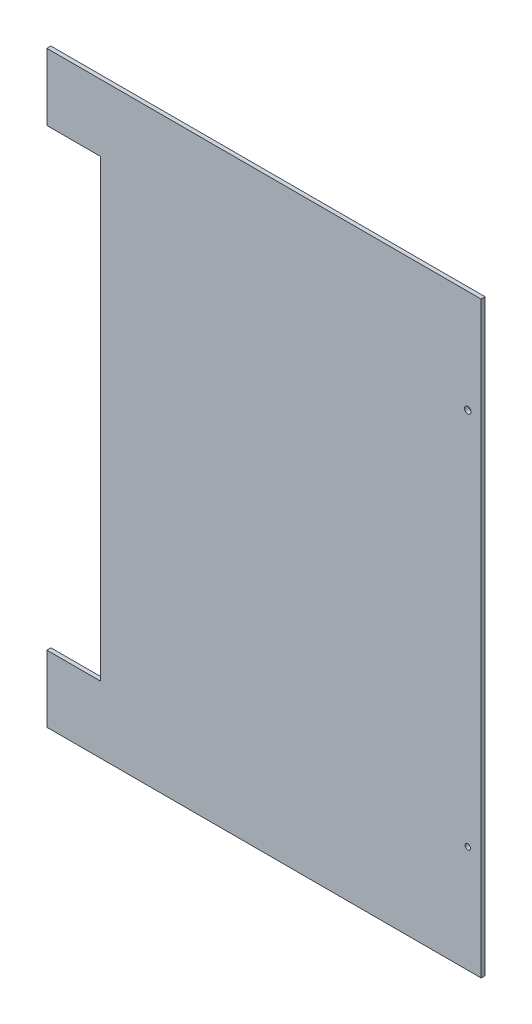
from build123d import *

# Parameters (mm, degrees)
SKETCH1_W           = 325
SKETCH1_H           = 70
SKETCH1_H_2         = 300
BOSS_EXTRUDE1_DEPTH = 3
SKETCH2_W           = 40
SKETCH2_H           = 340
CUT_EXTRUDE1_DEPTH  = 3
SKETCH3_R           = 2
SKETCH3_R_2         = 2.415919743
CUT_EXTRUDE2_DEPTH  = 3


with BuildPart() as part:
    # Sketch1 → Boss-Extrude1 (new body)
    with BuildSketch(Plane.XY):
        with Locations((16, 188.326300096)):
            Rectangle(SKETCH1_W, SKETCH1_H)
        with Locations((16, 3.326300096)):
            Rectangle(SKETCH1_W, SKETCH1_H_2)
        with Locations((16, -181.673699904)):
            Rectangle(SKETCH1_W, SKETCH1_H)
    extrude(amount=BOSS_EXTRUDE1_DEPTH)

    # Sketch2 → Cut-Extrude1 (cut)
    with BuildSketch(Plane.XY.offset(3)):
        with Locations((-126.5, 3.326300096)):
            Rectangle(SKETCH2_W, SKETCH2_H)
    extrude(amount=-CUT_EXTRUDE1_DEPTH, mode=Mode.SUBTRACT)

    # Sketch3 → Cut-Extrude2 (cut)
    with BuildSketch(Plane(origin=(0, 0, 0), x_dir=(-1, 0, 0), z_dir=(0, 0, -1))):
        with Locations((-168.5, -136.673699904)):
            Circle(SKETCH3_R)
        with Locations((-168.5, 146.326300096)):
            Circle(SKETCH3_R_2)
    extrude(amount=-CUT_EXTRUDE2_DEPTH, mode=Mode.SUBTRACT)


solid = part.part
